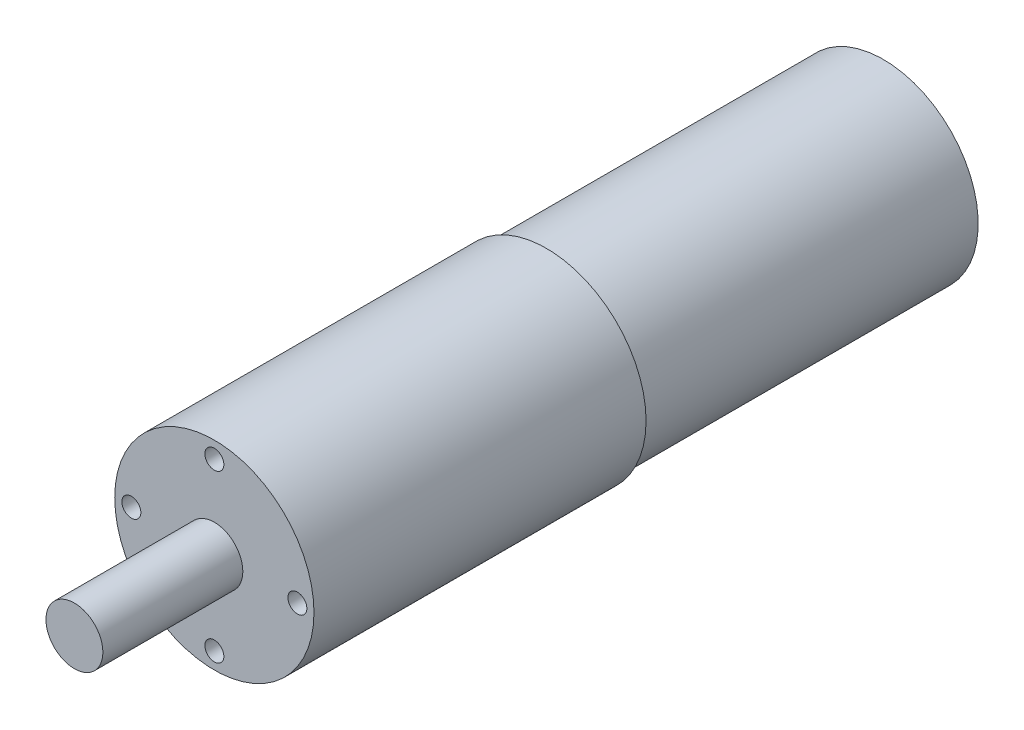
from build123d import *

# Parameters (mm, degrees)
SZKIC1_R                    = 21
DODANIE_WYCI_GNI_CIE1_DEPTH = 70
SZKIC2_R                    = 2
WYTNIJ_WYCI_GNI_CIE1_DEPTH  = 6
SZKIC3_R                    = 6
DODANIE_WYCI_GNI_CIE2_DEPTH = 29.5
SZKIC4_R                    = 20
DODANIE_WYCI_GNI_CIE3_DEPTH = 71


with BuildPart() as part:
    # Szkic1 → Dodanie-wyciągnięcie1 (new body)
    with BuildSketch(Plane.XY):
        Circle(SZKIC1_R)
    extrude(amount=DODANIE_WYCI_GNI_CIE1_DEPTH)

    # Szkic2 → Wytnij-wyciągnięcie1 (cut)
    with BuildSketch(Plane.XY.offset(70)):
        with Locations((0, 17.5)):
            Circle(SZKIC2_R)
        with Locations((17.5, 0)):
            Circle(SZKIC2_R)
        with Locations((0, -17.5)):
            Circle(SZKIC2_R)
        with Locations((-17.5, 0)):
            Circle(SZKIC2_R)
    extrude(amount=-WYTNIJ_WYCI_GNI_CIE1_DEPTH, mode=Mode.SUBTRACT)

    # Szkic3 → Dodanie-wyciągnięcie2 (add)
    with BuildSketch(Plane.XY.offset(70)):
        Circle(SZKIC3_R)
    extrude(amount=DODANIE_WYCI_GNI_CIE2_DEPTH)

    # Szkic4 → Dodanie-wyciągnięcie3 (add)
    with BuildSketch(Plane(origin=(0, 0, 0), x_dir=(-1, 0, 0), z_dir=(0, 0, -1))):
        Circle(SZKIC4_R)
    extrude(amount=DODANIE_WYCI_GNI_CIE3_DEPTH)


solid = part.part
